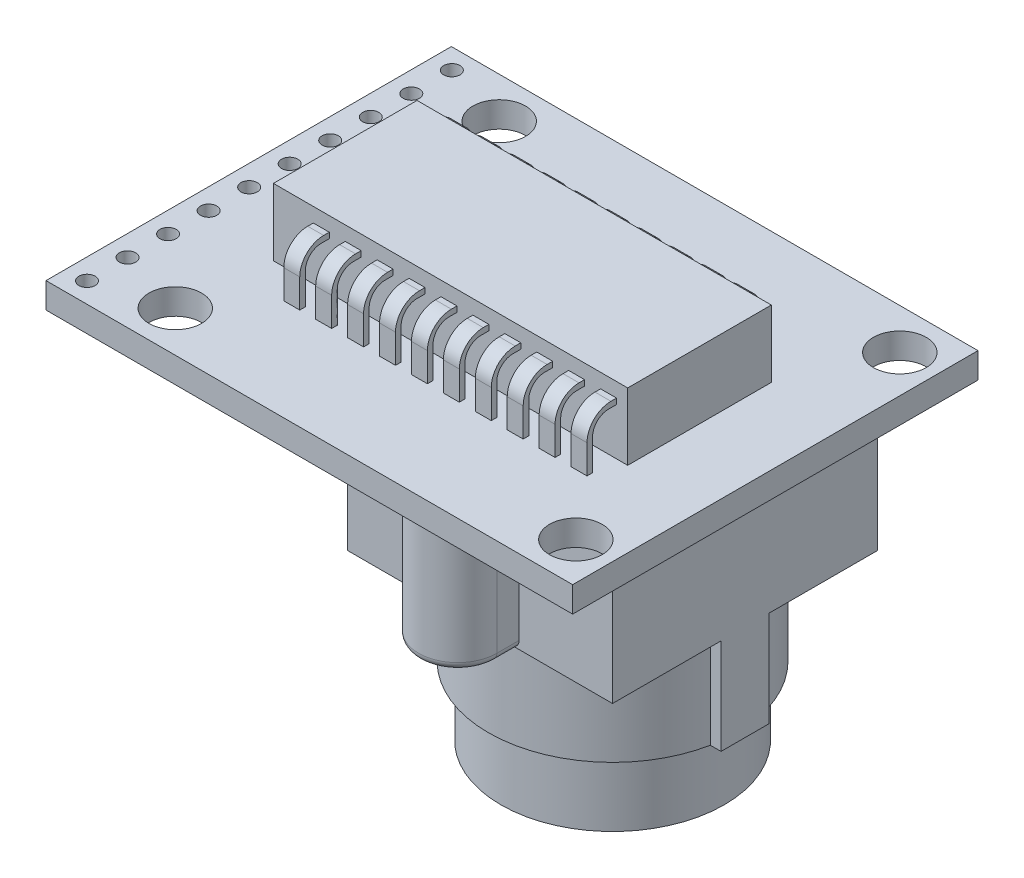
from build123d import *

# Parameters (mm, degrees)
CROQUIS1_W              = 33
CROQUIS1_H              = 25.4
CROQUIS1_R              = 0.51
CROQUIS1_R_2            = 1.65
SALIENTE_EXTRUIR1_DEPTH = 1.6
CROQUIS2_W              = 22.2
CROQUIS2_H              = 9
SALIENTE_EXTRUIR2_DEPTH = 4.2
CROQUIS3_W              = 1
CROQUIS3_H              = 0.35
SALIENTE_EXTRUIR3_DEPTH = 3.3
SALIENTE_EXTRUIR4_REACH = 27.604
CROQUIS4_W              = 1
CROQUIS4_H              = 0.35
SALIENTE_EXTRUIR5_REACH = 27.604
CROQUIS5_W              = 1
CROQUIS5_H              = 0.35
REDONDEO1_R             = 1
REDONDEO2_R             = 1.5
SALIENTE_EXTRUIR6_DEPTH = 8
REDONDEO3_R             = 0.5
SALIENTE_EXTRUIR7_DEPTH = 6
CROQUIS8_R              = 7
SALIENTE_EXTRUIR8_DEPTH = 4.3


with BuildPart() as part:
    # Croquis1 → Saliente-Extruir1 (new body)
    with BuildSketch(Plane(origin=(0, 0, 0), x_dir=(1, 0, 0), z_dir=(0, 1, 0))):
        Rectangle(CROQUIS1_W, CROQUIS1_H)
        with Locations(Location((-15.2, 11.43, 0), (0, 0, 270))):
            Circle(CROQUIS1_R, mode=Mode.SUBTRACT)
        with Locations(Location((-15.2, 8.89, 0), (0, 0, 270))):
            Circle(CROQUIS1_R, mode=Mode.SUBTRACT)
        with Locations(Location((-15.2, 6.35, 0), (0, 0, 270))):
            Circle(CROQUIS1_R, mode=Mode.SUBTRACT)
        with Locations(Location((-15.2, 3.81, 0), (0, 0, 270))):
            Circle(CROQUIS1_R, mode=Mode.SUBTRACT)
        with Locations(Location((-15.2, 1.27, 0), (0, 0, 270))):
            Circle(CROQUIS1_R, mode=Mode.SUBTRACT)
        with Locations(Location((-15.2, -1.27, 0), (0, 0, 270))):
            Circle(CROQUIS1_R, mode=Mode.SUBTRACT)
        with Locations(Location((-15.2, -3.81, 0), (0, 0, 270))):
            Circle(CROQUIS1_R, mode=Mode.SUBTRACT)
        with Locations(Location((-15.2, -6.35, 0), (0, 0, 270))):
            Circle(CROQUIS1_R, mode=Mode.SUBTRACT)
        with Locations(Location((-15.2, -8.89, 0), (0, 0, 270))):
            Circle(CROQUIS1_R, mode=Mode.SUBTRACT)
        with Locations(Location((-15.2, -11.43, 0), (0, 0, 270))):
            Circle(CROQUIS1_R, mode=Mode.SUBTRACT)
        with Locations(Location((14.15, 10.15, 0), (0, 0, 270))):
            Circle(CROQUIS1_R_2, mode=Mode.SUBTRACT)
        with Locations(Location((14.15, -10.15, 0), (0, 0, 90))):
            Circle(CROQUIS1_R_2, mode=Mode.SUBTRACT)
        with Locations(Location((-10.95, 10.15, 0), (0, 0, 270))):
            Circle(CROQUIS1_R_2, mode=Mode.SUBTRACT)
        with Locations(Location((-10.95, -10.15, 0), (0, 0, 90))):
            Circle(CROQUIS1_R_2, mode=Mode.SUBTRACT)
    extrude(amount=SALIENTE_EXTRUIR1_DEPTH)

    # Croquis2 → Saliente-Extruir2 (add)
    with BuildSketch(Plane(origin=(0, 1.6, 0), x_dir=(1, 0, 0), z_dir=(0, 1, 0))):
        with Locations((0.65, 0)):
            Rectangle(CROQUIS2_W, CROQUIS2_H)
    extrude(amount=SALIENTE_EXTRUIR2_DEPTH)

    # Croquis3 → Saliente-Extruir3 (add)
    with BuildSketch(Plane(origin=(0, 1.6, 0), x_dir=(1, 0, 0), z_dir=(0, 1, 0))):
        with Locations((10.55, -6.175)):
            Rectangle(CROQUIS3_W, CROQUIS3_H)
        with Locations((8.55, -6.175)):
            Rectangle(CROQUIS3_W, CROQUIS3_H)
        with Locations((6.55, -6.175)):
            Rectangle(CROQUIS3_W, CROQUIS3_H)
        with Locations((4.55, -6.175)):
            Rectangle(CROQUIS3_W, CROQUIS3_H)
        with Locations((2.55, -6.175)):
            Rectangle(CROQUIS3_W, CROQUIS3_H)
        with Locations((0.55, -6.175)):
            Rectangle(CROQUIS3_W, CROQUIS3_H)
        with Locations((-1.45, -6.175)):
            Rectangle(CROQUIS3_W, CROQUIS3_H)
        with Locations((-3.45, -6.175)):
            Rectangle(CROQUIS3_W, CROQUIS3_H)
        with Locations((-5.45, -6.175)):
            Rectangle(CROQUIS3_W, CROQUIS3_H)
        with Locations((-7.45, -6.175)):
            Rectangle(CROQUIS3_W, CROQUIS3_H)
        with Locations((-9.25, 6.175)):
            Rectangle(CROQUIS3_W, CROQUIS3_H)
        with Locations((-7.25, 6.175)):
            Rectangle(CROQUIS3_W, CROQUIS3_H)
        with Locations((-5.25, 6.175)):
            Rectangle(CROQUIS3_W, CROQUIS3_H)
        with Locations((-3.25, 6.175)):
            Rectangle(CROQUIS3_W, CROQUIS3_H)
        with Locations((-1.25, 6.175)):
            Rectangle(CROQUIS3_W, CROQUIS3_H)
        with Locations((0.75, 6.175)):
            Rectangle(CROQUIS3_W, CROQUIS3_H)
        with Locations((2.75, 6.175)):
            Rectangle(CROQUIS3_W, CROQUIS3_H)
        with Locations((4.75, 6.175)):
            Rectangle(CROQUIS3_W, CROQUIS3_H)
        with Locations((6.75, 6.175)):
            Rectangle(CROQUIS3_W, CROQUIS3_H)
        with Locations((8.75, 6.175)):
            Rectangle(CROQUIS3_W, CROQUIS3_H)
    extrude(amount=SALIENTE_EXTRUIR3_DEPTH)

    # Croquis4 → Saliente-Extruir4 (add, up to next)
    with BuildSketch(Plane(origin=(0, 0, 6), x_dir=(-1, 0, 0), z_dir=(0, 0, -1)), mode=Mode.PRIVATE) as saliente_extruir4_sk1:
        with Locations((-10.55, 4.725)):
            Rectangle(CROQUIS4_W, CROQUIS4_H)
    saliente_extruir4_tool1 = extrude(saliente_extruir4_sk1.sketch, amount=SALIENTE_EXTRUIR4_REACH, mode=Mode.PRIVATE) - part.part
    # Croquis4 → Saliente-Extruir4 (add, up to next)
    with BuildSketch(Plane(origin=(0, 0, 6), x_dir=(-1, 0, 0), z_dir=(0, 0, -1)), mode=Mode.PRIVATE) as saliente_extruir4_sk2:
        with Locations((-8.55, 4.725)):
            Rectangle(CROQUIS4_W, CROQUIS4_H)
    saliente_extruir4_tool2 = extrude(saliente_extruir4_sk2.sketch, amount=SALIENTE_EXTRUIR4_REACH, mode=Mode.PRIVATE) - part.part
    # Croquis4 → Saliente-Extruir4 (add, up to next)
    with BuildSketch(Plane(origin=(0, 0, 6), x_dir=(-1, 0, 0), z_dir=(0, 0, -1)), mode=Mode.PRIVATE) as saliente_extruir4_sk3:
        with Locations((-6.55, 4.725)):
            Rectangle(CROQUIS4_W, CROQUIS4_H)
    saliente_extruir4_tool3 = extrude(saliente_extruir4_sk3.sketch, amount=SALIENTE_EXTRUIR4_REACH, mode=Mode.PRIVATE) - part.part
    # Croquis4 → Saliente-Extruir4 (add, up to next)
    with BuildSketch(Plane(origin=(0, 0, 6), x_dir=(-1, 0, 0), z_dir=(0, 0, -1)), mode=Mode.PRIVATE) as saliente_extruir4_sk4:
        with Locations((-4.55, 4.725)):
            Rectangle(CROQUIS4_W, CROQUIS4_H)
    saliente_extruir4_tool4 = extrude(saliente_extruir4_sk4.sketch, amount=SALIENTE_EXTRUIR4_REACH, mode=Mode.PRIVATE) - part.part
    # Croquis4 → Saliente-Extruir4 (add, up to next)
    with BuildSketch(Plane(origin=(0, 0, 6), x_dir=(-1, 0, 0), z_dir=(0, 0, -1)), mode=Mode.PRIVATE) as saliente_extruir4_sk5:
        with Locations((-2.55, 4.725)):
            Rectangle(CROQUIS4_W, CROQUIS4_H)
    saliente_extruir4_tool5 = extrude(saliente_extruir4_sk5.sketch, amount=SALIENTE_EXTRUIR4_REACH, mode=Mode.PRIVATE) - part.part
    # Croquis4 → Saliente-Extruir4 (add, up to next)
    with BuildSketch(Plane(origin=(0, 0, 6), x_dir=(-1, 0, 0), z_dir=(0, 0, -1)), mode=Mode.PRIVATE) as saliente_extruir4_sk6:
        with Locations((-0.55, 4.725)):
            Rectangle(CROQUIS4_W, CROQUIS4_H)
    saliente_extruir4_tool6 = extrude(saliente_extruir4_sk6.sketch, amount=SALIENTE_EXTRUIR4_REACH, mode=Mode.PRIVATE) - part.part
    # Croquis4 → Saliente-Extruir4 (add, up to next)
    with BuildSketch(Plane(origin=(0, 0, 6), x_dir=(-1, 0, 0), z_dir=(0, 0, -1)), mode=Mode.PRIVATE) as saliente_extruir4_sk7:
        with Locations((1.45, 4.725)):
            Rectangle(CROQUIS4_W, CROQUIS4_H)
    saliente_extruir4_tool7 = extrude(saliente_extruir4_sk7.sketch, amount=SALIENTE_EXTRUIR4_REACH, mode=Mode.PRIVATE) - part.part
    # Croquis4 → Saliente-Extruir4 (add, up to next)
    with BuildSketch(Plane(origin=(0, 0, 6), x_dir=(-1, 0, 0), z_dir=(0, 0, -1)), mode=Mode.PRIVATE) as saliente_extruir4_sk8:
        with Locations((3.45, 4.725)):
            Rectangle(CROQUIS4_W, CROQUIS4_H)
    saliente_extruir4_tool8 = extrude(saliente_extruir4_sk8.sketch, amount=SALIENTE_EXTRUIR4_REACH, mode=Mode.PRIVATE) - part.part
    # Croquis4 → Saliente-Extruir4 (add, up to next)
    with BuildSketch(Plane(origin=(0, 0, 6), x_dir=(-1, 0, 0), z_dir=(0, 0, -1)), mode=Mode.PRIVATE) as saliente_extruir4_sk9:
        with Locations((5.45, 4.725)):
            Rectangle(CROQUIS4_W, CROQUIS4_H)
    saliente_extruir4_tool9 = extrude(saliente_extruir4_sk9.sketch, amount=SALIENTE_EXTRUIR4_REACH, mode=Mode.PRIVATE) - part.part
    # Croquis4 → Saliente-Extruir4 (add, up to next)
    with BuildSketch(Plane(origin=(0, 0, 6), x_dir=(-1, 0, 0), z_dir=(0, 0, -1)), mode=Mode.PRIVATE) as saliente_extruir4_sk10:
        with Locations((7.45, 4.725)):
            Rectangle(CROQUIS4_W, CROQUIS4_H)
    saliente_extruir4_tool10 = extrude(saliente_extruir4_sk10.sketch, amount=SALIENTE_EXTRUIR4_REACH, mode=Mode.PRIVATE) - part.part
    add(saliente_extruir4_tool1.solids().sort_by_distance((10.55, 4.725, 6))[0])
    add(saliente_extruir4_tool2.solids().sort_by_distance((8.55, 4.725, 6))[0])
    add(saliente_extruir4_tool3.solids().sort_by_distance((6.55, 4.725, 6))[0])
    add(saliente_extruir4_tool4.solids().sort_by_distance((4.55, 4.725, 6))[0])
    add(saliente_extruir4_tool5.solids().sort_by_distance((2.55, 4.725, 6))[0])
    add(saliente_extruir4_tool6.solids().sort_by_distance((0.55, 4.725, 6))[0])
    add(saliente_extruir4_tool7.solids().sort_by_distance((-1.45, 4.725, 6))[0])
    add(saliente_extruir4_tool8.solids().sort_by_distance((-3.45, 4.725, 6))[0])
    add(saliente_extruir4_tool9.solids().sort_by_distance((-5.45, 4.725, 6))[0])
    add(saliente_extruir4_tool10.solids().sort_by_distance((-7.45, 4.725, 6))[0])

    # Croquis5 → Saliente-Extruir5 (add, up to next)
    with BuildSketch(Plane.XY.offset(-6), mode=Mode.PRIVATE) as saliente_extruir5_sk1:
        with Locations((-9.25, 4.725)):
            Rectangle(CROQUIS5_W, CROQUIS5_H)
    saliente_extruir5_tool1 = extrude(saliente_extruir5_sk1.sketch, amount=SALIENTE_EXTRUIR5_REACH, mode=Mode.PRIVATE) - part.part
    # Croquis5 → Saliente-Extruir5 (add, up to next)
    with BuildSketch(Plane.XY.offset(-6), mode=Mode.PRIVATE) as saliente_extruir5_sk2:
        with Locations((-7.25, 4.725)):
            Rectangle(CROQUIS5_W, CROQUIS5_H)
    saliente_extruir5_tool2 = extrude(saliente_extruir5_sk2.sketch, amount=SALIENTE_EXTRUIR5_REACH, mode=Mode.PRIVATE) - part.part
    # Croquis5 → Saliente-Extruir5 (add, up to next)
    with BuildSketch(Plane.XY.offset(-6), mode=Mode.PRIVATE) as saliente_extruir5_sk3:
        with Locations((-5.25, 4.725)):
            Rectangle(CROQUIS5_W, CROQUIS5_H)
    saliente_extruir5_tool3 = extrude(saliente_extruir5_sk3.sketch, amount=SALIENTE_EXTRUIR5_REACH, mode=Mode.PRIVATE) - part.part
    # Croquis5 → Saliente-Extruir5 (add, up to next)
    with BuildSketch(Plane.XY.offset(-6), mode=Mode.PRIVATE) as saliente_extruir5_sk4:
        with Locations((-3.25, 4.725)):
            Rectangle(CROQUIS5_W, CROQUIS5_H)
    saliente_extruir5_tool4 = extrude(saliente_extruir5_sk4.sketch, amount=SALIENTE_EXTRUIR5_REACH, mode=Mode.PRIVATE) - part.part
    # Croquis5 → Saliente-Extruir5 (add, up to next)
    with BuildSketch(Plane.XY.offset(-6), mode=Mode.PRIVATE) as saliente_extruir5_sk5:
        with Locations((-1.25, 4.725)):
            Rectangle(CROQUIS5_W, CROQUIS5_H)
    saliente_extruir5_tool5 = extrude(saliente_extruir5_sk5.sketch, amount=SALIENTE_EXTRUIR5_REACH, mode=Mode.PRIVATE) - part.part
    # Croquis5 → Saliente-Extruir5 (add, up to next)
    with BuildSketch(Plane.XY.offset(-6), mode=Mode.PRIVATE) as saliente_extruir5_sk6:
        with Locations((0.75, 4.725)):
            Rectangle(CROQUIS5_W, CROQUIS5_H)
    saliente_extruir5_tool6 = extrude(saliente_extruir5_sk6.sketch, amount=SALIENTE_EXTRUIR5_REACH, mode=Mode.PRIVATE) - part.part
    # Croquis5 → Saliente-Extruir5 (add, up to next)
    with BuildSketch(Plane.XY.offset(-6), mode=Mode.PRIVATE) as saliente_extruir5_sk7:
        with Locations((2.75, 4.725)):
            Rectangle(CROQUIS5_W, CROQUIS5_H)
    saliente_extruir5_tool7 = extrude(saliente_extruir5_sk7.sketch, amount=SALIENTE_EXTRUIR5_REACH, mode=Mode.PRIVATE) - part.part
    # Croquis5 → Saliente-Extruir5 (add, up to next)
    with BuildSketch(Plane.XY.offset(-6), mode=Mode.PRIVATE) as saliente_extruir5_sk8:
        with Locations((4.75, 4.725)):
            Rectangle(CROQUIS5_W, CROQUIS5_H)
    saliente_extruir5_tool8 = extrude(saliente_extruir5_sk8.sketch, amount=SALIENTE_EXTRUIR5_REACH, mode=Mode.PRIVATE) - part.part
    # Croquis5 → Saliente-Extruir5 (add, up to next)
    with BuildSketch(Plane.XY.offset(-6), mode=Mode.PRIVATE) as saliente_extruir5_sk9:
        with Locations((6.75, 4.725)):
            Rectangle(CROQUIS5_W, CROQUIS5_H)
    saliente_extruir5_tool9 = extrude(saliente_extruir5_sk9.sketch, amount=SALIENTE_EXTRUIR5_REACH, mode=Mode.PRIVATE) - part.part
    # Croquis5 → Saliente-Extruir5 (add, up to next)
    with BuildSketch(Plane.XY.offset(-6), mode=Mode.PRIVATE) as saliente_extruir5_sk10:
        with Locations((8.75, 4.725)):
            Rectangle(CROQUIS5_W, CROQUIS5_H)
    saliente_extruir5_tool10 = extrude(saliente_extruir5_sk10.sketch, amount=SALIENTE_EXTRUIR5_REACH, mode=Mode.PRIVATE) - part.part
    add(saliente_extruir5_tool1.solids().sort_by_distance((-9.25, 4.725, -6))[0])
    add(saliente_extruir5_tool2.solids().sort_by_distance((-7.25, 4.725, -6))[0])
    add(saliente_extruir5_tool3.solids().sort_by_distance((-5.25, 4.725, -6))[0])
    add(saliente_extruir5_tool4.solids().sort_by_distance((-3.25, 4.725, -6))[0])
    add(saliente_extruir5_tool5.solids().sort_by_distance((-1.25, 4.725, -6))[0])
    add(saliente_extruir5_tool6.solids().sort_by_distance((0.75, 4.725, -6))[0])
    add(saliente_extruir5_tool7.solids().sort_by_distance((2.75, 4.725, -6))[0])
    add(saliente_extruir5_tool8.solids().sort_by_distance((4.75, 4.725, -6))[0])
    add(saliente_extruir5_tool9.solids().sort_by_distance((6.75, 4.725, -6))[0])
    add(saliente_extruir5_tool10.solids().sort_by_distance((8.75, 4.725, -6))[0])

    # Redondeo1
    redondeo1_edges = [part.edges().sort_by_distance(p)[0] for p in [
        (10.55, 4.55, 6),
        (8.55, 4.55, 6),
        (6.55, 4.55, 6),
        (4.55, 4.55, 6),
        (2.55, 4.55, 6),
        (0.55, 4.55, 6),
        (-1.45, 4.55, 6),
        (-3.45, 4.55, 6),
        (-5.45, 4.55, 6),
        (-7.45, 4.55, 6),
        (-9.25, 4.55, -6),
        (-7.25, 4.55, -6),
        (-5.25, 4.55, -6),
        (-3.25, 4.55, -6),
        (-1.25, 4.55, -6),
        (0.75, 4.55, -6),
        (2.75, 4.55, -6),
        (4.75, 4.55, -6),
        (6.75, 4.55, -6),
        (8.75, 4.55, -6),
    ]]
    fillet(redondeo1_edges, radius=REDONDEO1_R)

    # Redondeo2
    redondeo2_edges = [part.edges().sort_by_distance(p)[0] for p in [
        (-9.25, 4.9, -6.35),
        (8.55, 4.9, 6.35),
        (6.55, 4.9, 6.35),
        (4.55, 4.9, 6.35),
        (2.55, 4.9, 6.35),
        (0.55, 4.9, 6.35),
        (-1.45, 4.9, 6.35),
        (-3.45, 4.9, 6.35),
        (-5.45, 4.9, 6.35),
        (-7.45, 4.9, 6.35),
        (-7.25, 4.9, -6.35),
        (-5.25, 4.9, -6.35),
        (-3.25, 4.9, -6.35),
        (-1.25, 4.9, -6.35),
        (0.75, 4.9, -6.35),
        (2.75, 4.9, -6.35),
        (4.75, 4.9, -6.35),
        (6.75, 4.9, -6.35),
        (8.75, 4.9, -6.35),
        (10.55, 4.9, 6.35),
    ]]
    fillet(redondeo2_edges, radius=REDONDEO2_R)

    # Croquis6 → Saliente-Extruir6 (add)
    with BuildSketch(Plane.XZ):
        with BuildLine():
            Line((-2, -8.3), (3.85, -8.3))
            Line((3.85, -8.3), (3.85, -9.7))
            ThreePointArc((3.85, -9.7), (6.3, -12.15), (8.75, -9.7))
            Line((8.75, -9.7), (8.75, -8.3))
            Line((8.75, -8.3), (14.6, -8.3))
            Line((14.6, -8.3), (14.6, 8.3))
            Line((14.6, 8.3), (8.75, 8.3))
            Line((8.75, 8.3), (8.75, 9.7))
            ThreePointArc((8.75, 9.7), (6.3, 12.15), (3.85, 9.7))
            Line((3.85, 9.7), (3.85, 8.3))
            Line((3.85, 8.3), (-2, 8.3))
            Line((-2, 8.3), (-2, -8.3))
        make_face()
    extrude(amount=SALIENTE_EXTRUIR6_DEPTH)

    # Redondeo3
    redondeo3_edges = [part.edges().sort_by_distance(p)[0] for p in [
        (8.75, -8, 9),
        (6.3, -8, 12.15),
        (3.85, -8, 9),
        (3.85, -8, -9),
        (6.3, -8, -12.15),
        (8.75, -8, -9),
    ]]
    fillet(redondeo3_edges, radius=REDONDEO3_R)

    # Croquis7 → Saliente-Extruir7 (add)
    with BuildSketch(Plane.XZ.offset(8)):
        with BuildLine():
            Line((14.6, -1.5), (14.6, 1.5))
            Line((14.6, 1.5), (13.928933412, 1.5))
            ThreePointArc((13.928933412, 1.5), (-1.475, 0), (13.928933412, -1.5))
            Line((13.928933412, -1.5), (14.6, -1.5))
        make_face()
    extrude(amount=SALIENTE_EXTRUIR7_DEPTH)

    # Croquis8 → Saliente-Extruir8 (add)
    with BuildSketch(Plane.XZ.offset(14)):
        with Locations(Location((6.3, 0, 0), (0, 0, 90))):
            Circle(CROQUIS8_R)
    extrude(amount=SALIENTE_EXTRUIR8_DEPTH)


solid = part.part
